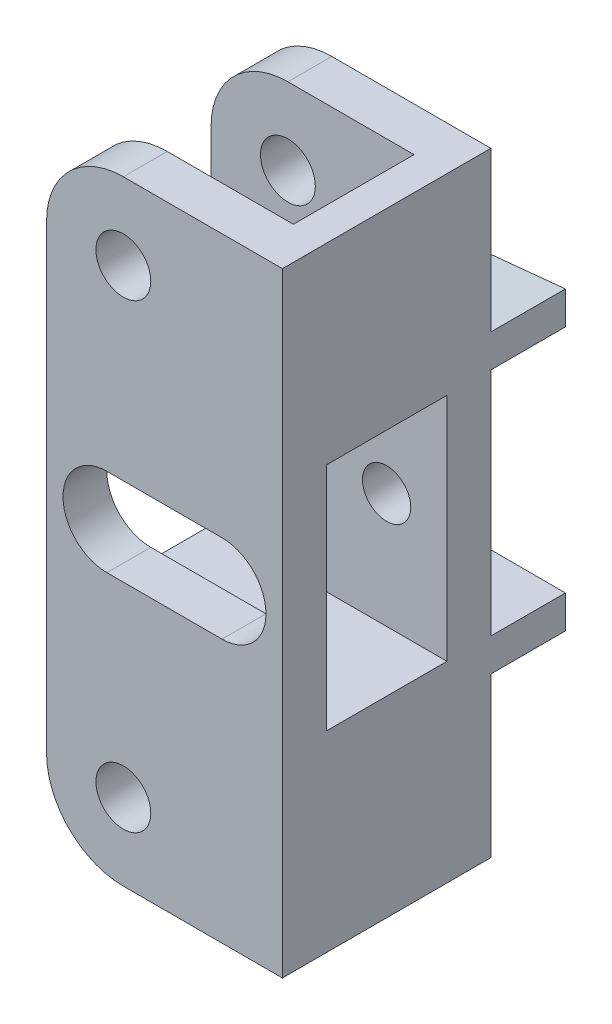
from build123d import *

# Parameters (mm, degrees)
SKETCH_1_R      = 2.5
EXTRUDE_1_DEPTH = 4
EXTRUDE_2_DEPTH = 11
EXTRUDE_START   = -15
SKETCH_1_6_R    = 2.5
SKETCH_1_6_R_2  = 2.2
EXTRUDE_3_DEPTH = 4
EXTRUDE_4_DEPTH = 6.8
FILLET_1_R      = 5


with BuildPart() as part:
    # 草图1 → 凸台-拉伸1 (new body)
    with BuildSketch(Plane.XY):
        with BuildLine():
            ThreePointArc((-43, 28), (-47.949747468, 25.949747468), (-50, 21))
            Line((-50, 21), (-50, -21))
            ThreePointArc((-50, -21), (-47.949747468, -25.949747468), (-43, -28))
            Line((-43, -28), (-28.5, -28))
            Line((-28.5, -28), (-28.5, 28))
            Line((-28.5, 28), (-43, 28))
        make_face()
        with Locations((-43, 21)):
            Circle(SKETCH_1_R, mode=Mode.SUBTRACT)
        with BuildLine():
            Line((-44.5, 4), (-34, 4))
            ThreePointArc((-34, 4), (-30, 0), (-34, -4))
            Line((-34, -4), (-44.5, -4))
            ThreePointArc((-44.5, -4), (-48.5, 0), (-44.5, 4))
        make_face(mode=Mode.SUBTRACT)
        with Locations((-43, -21)):
            Circle(SKETCH_1_R, mode=Mode.SUBTRACT)
    extrude(amount=EXTRUDE_1_DEPTH)

    # 草图1<5> → 凸台-拉伸2 (add)
    with BuildSketch(Plane.XY):
        with BuildLine():
            Line((-43, 12.1), (-50, 12.1))
            Line((-50, 12.1), (-50, 10.5))
            Line((-50, 10.5), (-28.5, 10.5))
            Line((-28.5, 10.5), (-28.5, 28))
            Line((-28.5, 28), (-31.5, 28))
            Line((-31.5, 28), (-34.502137832, 18.354940724))
            ThreePointArc((-34.502137832, 18.354940724), (-37.724160141, 13.832328567), (-43, 12.1))
        make_face()
        with BuildLine():
            Line((-28.5, -10.5), (-50, -10.5))
            Line((-50, -10.5), (-50, -12.1))
            Line((-50, -12.1), (-43, -12.1))
            ThreePointArc((-43, -12.1), (-37.724160141, -13.832328567), (-34.502137832, -18.354940724))
            Line((-34.502137832, -18.354940724), (-31.5, -28))
            Line((-31.5, -28), (-28.5, -28))
            Line((-28.5, -28), (-28.5, -10.5))
        make_face()
    extrude(amount=-EXTRUDE_2_DEPTH)

    # 草图1<6> → 凸台-拉伸3 (add)
    with BuildSketch(Plane.XY.offset(EXTRUDE_START)):
        with BuildLine():
            ThreePointArc((-43, 28), (-47.949747468, 25.949747468), (-50, 21))
            Line((-50, 21), (-50, -21))
            ThreePointArc((-50, -21), (-47.949747468, -25.949747468), (-43, -28))
            Line((-43, -28), (-28.5, -28))
            Line((-28.5, -28), (-28.5, 28))
            Line((-28.5, 28), (-43, 28))
        make_face()
        with Locations((-43, 21)):
            Circle(SKETCH_1_6_R, mode=Mode.SUBTRACT)
        with Locations((-43, -21)):
            Circle(SKETCH_1_6_R, mode=Mode.SUBTRACT)
        with Locations((-34, 0)):
            Circle(SKETCH_1_6_R_2, mode=Mode.SUBTRACT)
        with Locations((-44.5, 0)):
            Circle(SKETCH_1_6_R_2, mode=Mode.SUBTRACT)
    extrude(amount=EXTRUDE_3_DEPTH)

    # 草图1<7> → 凸台-拉伸4 (add)
    with BuildSketch(Plane.XY.offset(EXTRUDE_START)):
        with BuildLine():
            Line((-43, 12.1), (-50, 12.1))
            Line((-50, 12.1), (-50, 10.5))
            Line((-50, 10.5), (-28.5, 10.5))
            Line((-28.5, 10.5), (-28.5, 13.5))
            Line((-28.5, 13.5), (-42.118030123, 12.143808429))
            ThreePointArc((-42.118030123, 12.143808429), (-42.558471393, 12.110958854), (-43, 12.1))
        make_face()
        with BuildLine():
            Line((-28.5, -10.5), (-50, -10.5))
            Line((-50, -10.5), (-50, -12.1))
            Line((-50, -12.1), (-43, -12.1))
            ThreePointArc((-43, -12.1), (-42.558471393, -12.110958854), (-42.118030123, -12.143808429))
            Line((-42.118030123, -12.143808429), (-28.5, -13.5))
            Line((-28.5, -13.5), (-28.5, -10.5))
        make_face()
    extrude(amount=-EXTRUDE_4_DEPTH)

    # 圆角1
    fillet_1_edges = [part.edges().sort_by_distance(p)[0] for p in [
        (-50, 11.3, -21.8),
        (-50, -11.3, -21.8),
    ]]
    fillet(fillet_1_edges, radius=FILLET_1_R)


solid = part.part
